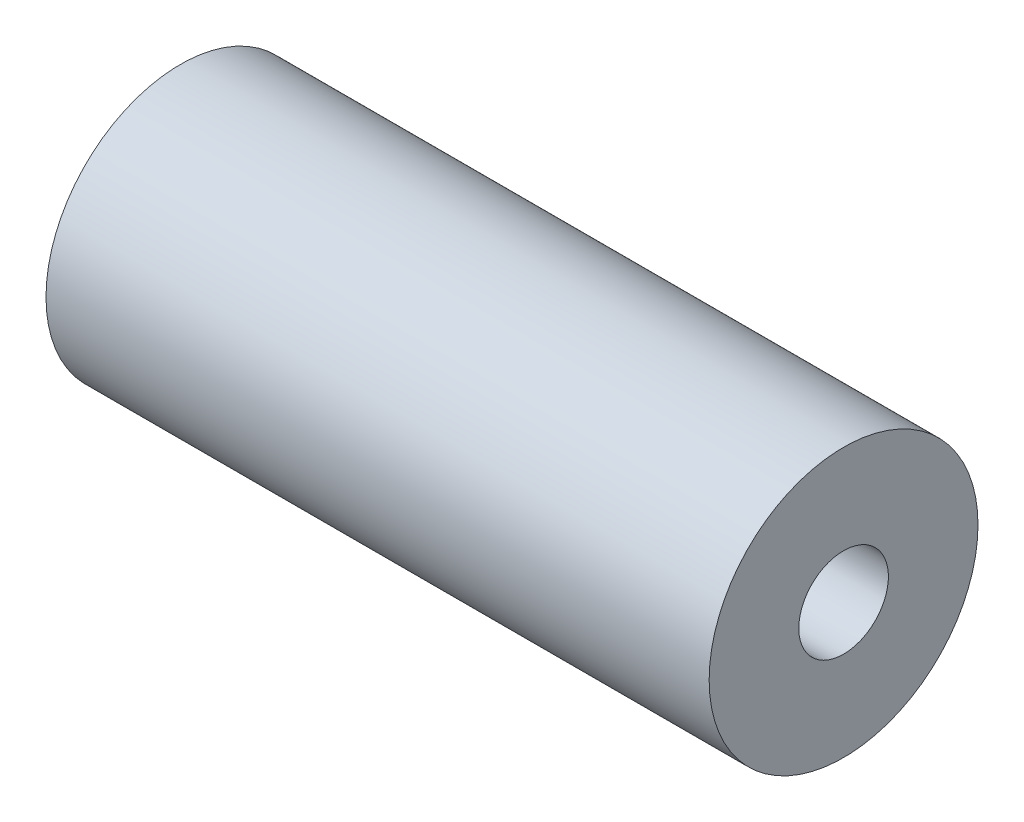
from build123d import *

# Parameters (mm, degrees)
AXIAL_PROFILE_MM_W = 37
AXIAL_PROFILE_MM_H = 5


with BuildPart() as part:
    # Axial profile (mm) → Full revolution (revolve)
    with BuildSketch(Plane.XY, mode=Mode.PRIVATE) as full_revolution_sk:
        with Locations((-121.5, 5)):
            Rectangle(AXIAL_PROFILE_MM_W, AXIAL_PROFILE_MM_H)
    revolve(full_revolution_sk.sketch.rotate(Axis((-110, 0, 0), (1, 0, 0)), 90), axis=Axis((-110, 0, 0), (1, 0, 0)))


solid = part.part
